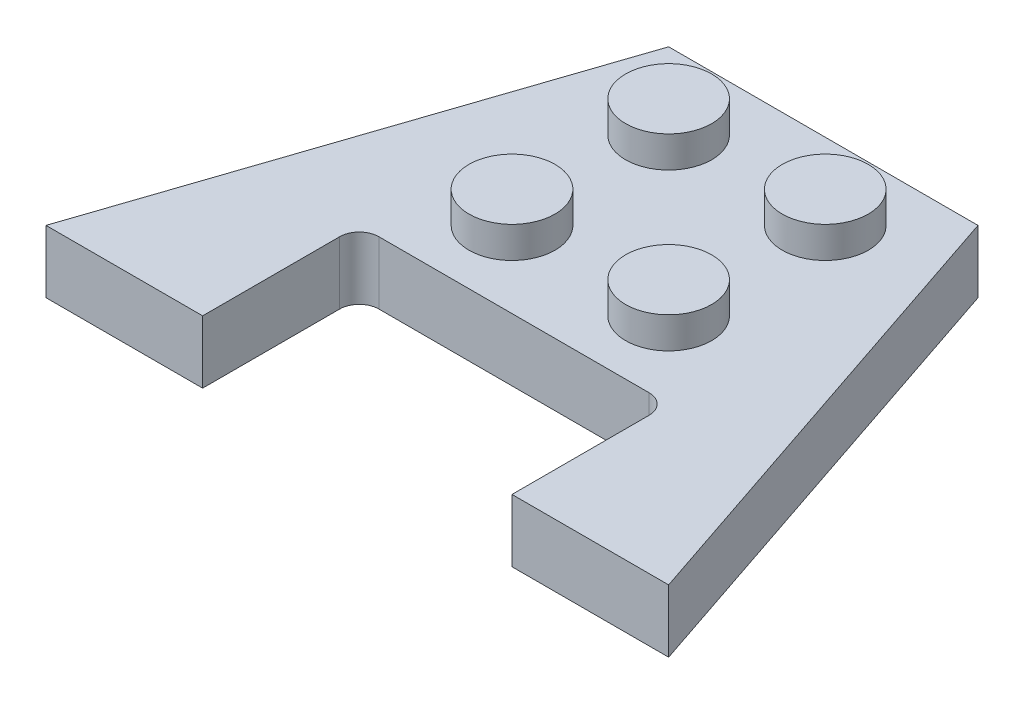
from build123d import *

# Parameters (mm, degrees)
BASEFRAMESKETCH_W           = 15.8
BASEFRAMESKETCH_H           = 3.2
BASEFRAME_DEPTH             = 7.9
STUDSSKETCH_R               = 2.197938665
STUDS_DEPTH                 = 1.6
MAINSTUDSPATTERN_COUNT      = 2
MAINSTUDSPATTERN_PITCH      = 8
MAINSTUDSPATTERN_COUNT_DIR2 = 2
MAINSTUDSPATTERN_PITCH_DIR2 = 8
MAINBASESHELL_T             = -1.2
UNDERCIRCLESKETCH_R         = 3.25
UNDERCIRCLESKETCH_R_2       = 2.4
UNDERCIRCLEEXTRUDE_DEPTH    = 1.8
ASHAPEDEDGECUT_DEPTH        = 2
FILLET13_R                  = 1


with BuildPart() as part:
    # BaseFrameSketch → BaseFrame (new, symmetric)
    with BuildSketch(Plane.XY):
        with Locations((-4.584729064, 1.6)):
            Rectangle(BASEFRAMESKETCH_W, BASEFRAMESKETCH_H)
    extrude(amount=BASEFRAME_DEPTH, both=True)

    # StudsSketch → Studs (add)
    with BuildSketch(Plane(origin=(0, 3.2, 0), x_dir=(1, 0, 0), z_dir=(0, 1, 0))):
        with Locations((-8.584729064, 4)):
            Circle(STUDSSKETCH_R)
    studs = extrude(amount=STUDS_DEPTH)

    # MainStudsPattern: Studs 2 × 2
    with Locations(*[(i * MAINSTUDSPATTERN_PITCH, 0, j * MAINSTUDSPATTERN_PITCH_DIR2) for i in range(MAINSTUDSPATTERN_COUNT) for j in range(MAINSTUDSPATTERN_COUNT_DIR2) if (i, j) != (0, 0)]):
        add(studs)

    # MainBaseShell
    mainbaseshell_openings = [part.faces().sort_by_distance(p)[0] for p in [
        (-4.584729064, 0, 0),
    ]]
    offset(amount=MAINBASESHELL_T, openings=mainbaseshell_openings, kind=Kind.INTERSECTION)

    # UnderCircleSketch → UnderCircleExtrude (add)
    with BuildSketch(Plane(origin=(0, 2, 0), x_dir=(-1, 0, 0), z_dir=(0, -1, 0))):
        with Locations(Location((4.584729064, 0, 0), (0, 0, 270))):
            Circle(UNDERCIRCLESKETCH_R)
        with Locations(Location((4.584729064, 0, 0), (0, 0, 270))):
            Circle(UNDERCIRCLESKETCH_R_2, mode=Mode.SUBTRACT)
    extrude(amount=UNDERCIRCLEEXTRUDE_DEPTH)

    # Sweep1: sweep along a curve in space
    with BuildLine() as sweep1_path:
        Line((3.315270936, 0, 7.9), (3.315270936, 3.2, 7.9))
    # Sketch10 → Sweep1 (sweep)
    with BuildSketch(Plane(origin=(0, 3.2, 0), x_dir=(1, 0, 0), z_dir=(0, 1, 0))):
        Polygon((-12.484729064, 7.9), (-20.484729064, -15.9), (-12.484729064, -15.9), align=None)
        Polygon((3.315270936, 7.9), (3.315270936, -15.9), (11.315270936, -15.9), align=None)
    sweep(path=sweep1_path.line)

    # Sketch11 → AShapedEdgeCut (cut)
    with BuildSketch(Plane(origin=(0, 0, 0), x_dir=(-1, 0, 0), z_dir=(0, -1, 0))):
        Polygon((-3.315270936, 3.352483875), (-3.598074089, 3.352483875), (-5.380624164, -1.900141374), (-6.136343318, -1.900141374), (-7.584500421, -6.930903588), (-3.315270936, -6.930903588), (-3.315270936, -4.81), (-5.328079185, -4.81), (-5.328079185, -3.61), (-3.315270936, -3.61), align=None)
        Polygon((-7.759680606, -8.895572671), (-7.759680606, -9.725211817), (-6.559680606, -9.725211817), (-6.559680606, -8.130903588), (-4.406736771, -8.130903588), (-4.406736771, -14.91), (-9.466166686, -14.91), (-9.466166686, -14.321814496), (-9.687501352, -14.236531964), (-8.150050802, -8.895572671), align=None)
        Polygon((-2.115270936, 4.601321399), (-2.895270936, 4.601321399), (-2.295270936, 6.7), (-2.115270936, 6.7), align=None)
        Polygon((11.284729064, 4.601321399), (11.284729064, 6.7), (11.464729064, 6.7), (12.064729064, 4.601321399), align=None)
        Polygon((13.576194899, -14.91), (18.635624814, -14.91), (18.635624814, -14.321814496), (18.85695948, -14.236531964), (17.31950893, -8.895572671), (16.929138734, -8.895572671), (16.929138734, -9.725211817), (15.729138734, -9.725211817), (15.729138734, -8.130903588), (13.576194899, -8.130903588), align=None)
        Polygon((12.484729064, -4.81), (12.484729064, -6.930903588), (16.753958549, -6.930903588), (15.305801446, -1.900141374), (14.550082292, -1.900141374), (12.767532217, 3.352483875), (12.484729064, 3.352483875), (12.484729064, -3.61), (14.497537313, -3.61), (14.497537313, -4.81), align=None)
    extrude(amount=-ASHAPEDEDGECUT_DEPTH, mode=Mode.SUBTRACT)

    # Fillet13
    fillet13_edges = [part.edges().sort_by_distance(p)[0] for p in [
        (3.315270936, 1.6, 7.9),
        (-12.484729064, 1.6, 7.9),
    ]]
    fillet(fillet13_edges, radius=FILLET13_R)


solid = part.part
